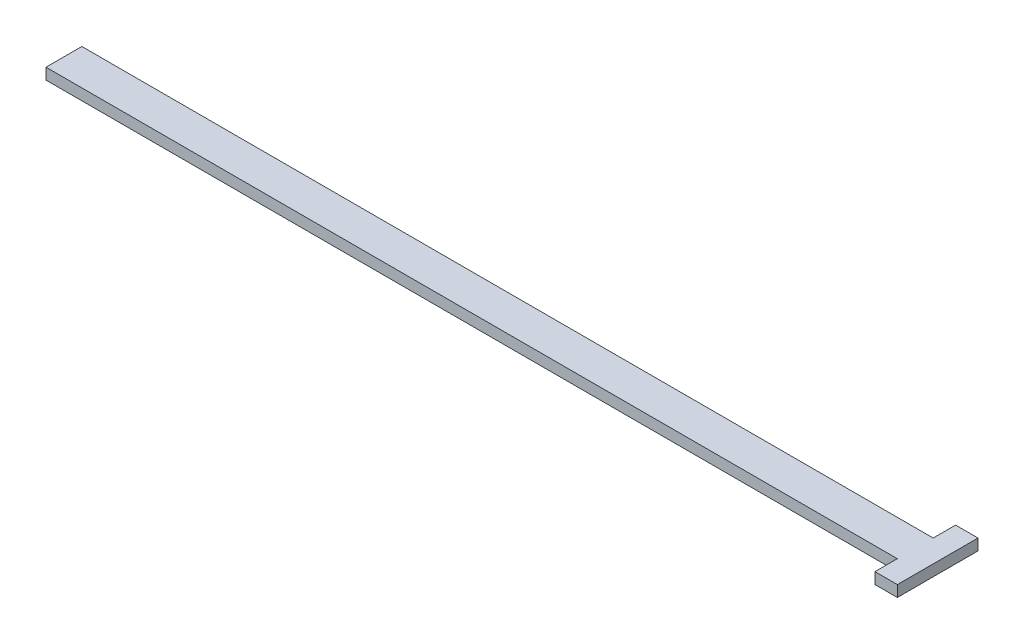
from build123d import *

# Parameters (mm, degrees)
SKETCH1_W           = 247.65
SKETCH1_H           = 22.86
BOSS_EXTRUDE1_DEPTH = 3.175
SKETCH3_W           = 241.3
SKETCH3_H           = 6.35
CUT_EXTRUDE2_DEPTH  = 125.39194568


with BuildPart() as part:
    # Sketch1 → Boss-Extrude1 (new body)
    with BuildSketch(Plane(origin=(0, 0, 0), x_dir=(1, 0, 0), z_dir=(0, 1, 0))):
        Rectangle(SKETCH1_W, SKETCH1_H)
    extrude(amount=BOSS_EXTRUDE1_DEPTH)

    # Sketch3 → Cut-Extrude2 (cut, through all)
    with BuildSketch(Plane(origin=(0, 3.175, 0), x_dir=(1, 0, 0), z_dir=(0, 1, 0))):
        with Locations((-3.175, 8.255)):
            Rectangle(SKETCH3_W, SKETCH3_H)
        with Locations((-3.175, -8.255)):
            Rectangle(SKETCH3_W, SKETCH3_H)
    extrude(amount=-CUT_EXTRUDE2_DEPTH, mode=Mode.SUBTRACT)


solid = part.part
